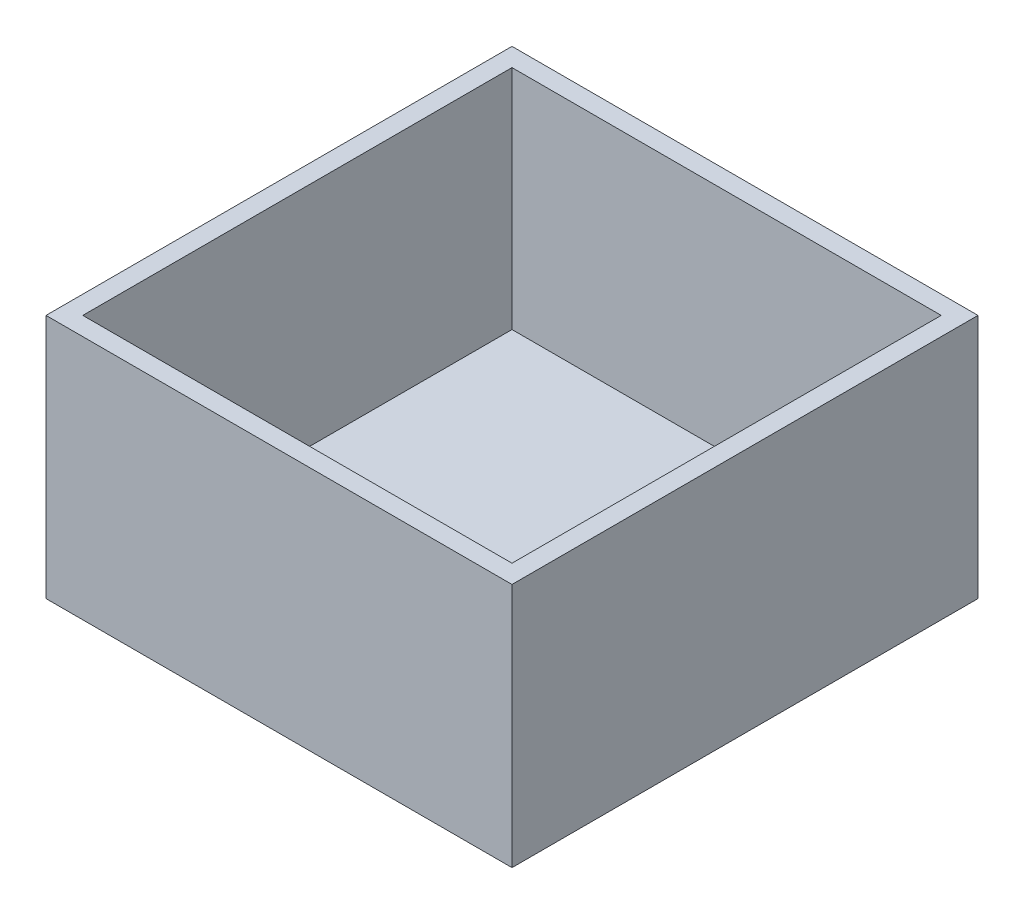
from build123d import *

# Parameters (mm, degrees)
SKETCH1_W           = 76
SKETCH1_H           = 76
SKETCH1_W_2         = 70
SKETCH1_H_2         = 70
BOSS_EXTRUDE1_DEPTH = 40
SKETCH2_W           = 70
SKETCH2_H           = 70
BOSS_EXTRUDE2_DEPTH = 3


with BuildPart() as part:
    # Sketch1 → Boss-Extrude1 (new body)
    with BuildSketch(Plane(origin=(0, 0, 0), x_dir=(1, 0, 0), z_dir=(0, 1, 0))):
        with Locations((35, 35)):
            Rectangle(SKETCH1_W, SKETCH1_H)
        with Locations((35, 35)):
            Rectangle(SKETCH1_W_2, SKETCH1_H_2, mode=Mode.SUBTRACT)
    extrude(amount=BOSS_EXTRUDE1_DEPTH)

    # Sketch2 → Boss-Extrude2 (add)
    with BuildSketch(Plane.XZ):
        with Locations((35, -35)):
            Rectangle(SKETCH2_W, SKETCH2_H)
    extrude(amount=-BOSS_EXTRUDE2_DEPTH)


solid = part.part
